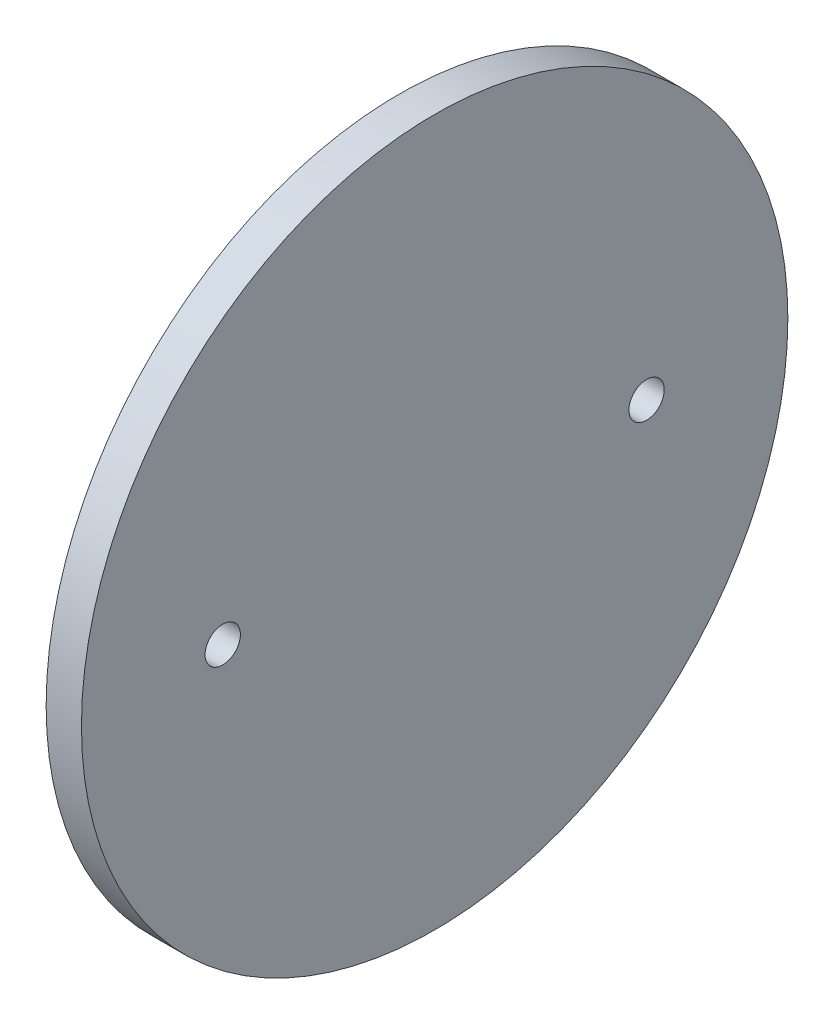
from build123d import *

# Parameters (mm, degrees)
SKETCH1_R           = 63.5
SKETCH1_R_2         = 3.175
BOSS_EXTRUDE1_DEPTH = 6.35


with BuildPart() as part:
    # Sketch1 → Boss-Extrude1 (new body)
    with BuildSketch(Plane(origin=(0, 0, 0), x_dir=(0, 0, -1), z_dir=(1, 0, 0))):
        Circle(SKETCH1_R)
        with Locations((38.1, 0)):
            Circle(SKETCH1_R_2, mode=Mode.SUBTRACT)
        with Locations((-38.1, 0)):
            Circle(SKETCH1_R_2, mode=Mode.SUBTRACT)
    extrude(amount=BOSS_EXTRUDE1_DEPTH)


solid = part.part
